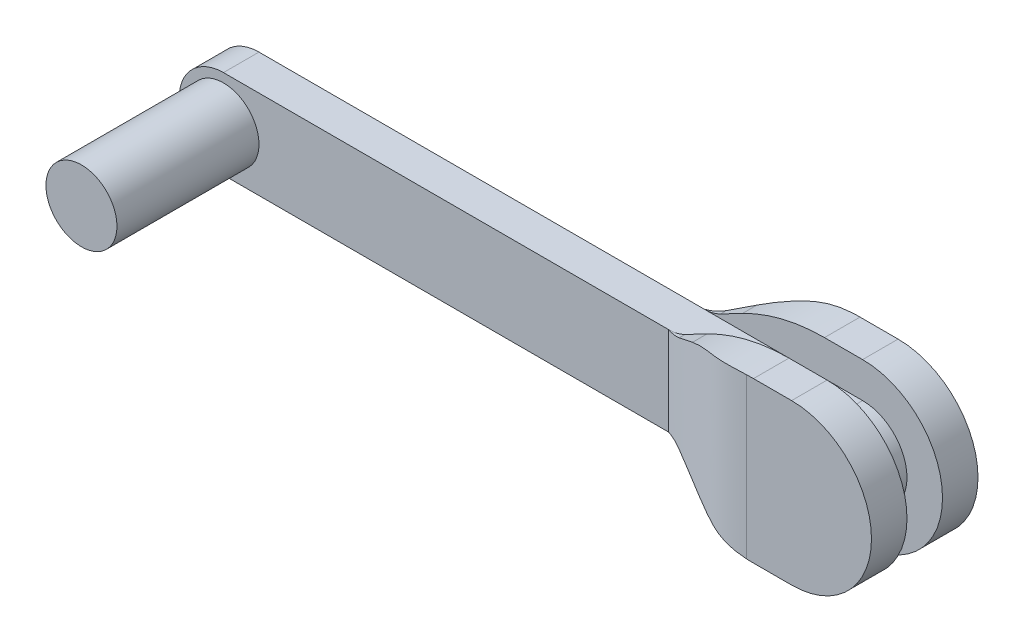
from build123d import *

# Parameters (mm, degrees)
BOSS_EXTRUDE1_DEPTH = 2
SKETCH2_R           = 2
BOSS_EXTRUDE2_DEPTH = 8
SKETCH5_R           = 2
CUT_EXTRUDE2_DEPTH  = 4
BOSS_EXTRUDE3_DEPTH = 2
CUT_EXTRUDE1_DEPTH  = 5.5


with BuildPart() as part:
    # Sketch1 → Boss-Extrude1 (new body)
    with BuildSketch(Plane.XY):
        with BuildLine():
            Line((0, -2.5), (34, -2.5))
            ThreePointArc((34, -2.5), (36.5, 0), (34, 2.5))
            Line((34, 2.5), (0, 2.5))
            ThreePointArc((0, 2.5), (-2.5, 0), (0, -2.5))
        make_face()
    extrude(amount=BOSS_EXTRUDE1_DEPTH)

    # Sketch2 → Boss-Extrude2 (add)
    with BuildSketch(Plane.XY.offset(2)):
        Circle(SKETCH2_R)
    extrude(amount=BOSS_EXTRUDE2_DEPTH)

    # Sketch5 → Cut-Extrude2 (cut, symmetric)
    with BuildSketch(Plane(origin=(0, 0, 0), x_dir=(-1, 0, 0), z_dir=(0, 0, -1))):
        with Locations(Location((-34, 0, 0), (0, 0, 180))):
            Circle(SKETCH5_R)
    extrude(amount=CUT_EXTRUDE2_DEPTH, both=True, mode=Mode.SUBTRACT)

    # Sketch3 → Boss-Extrude3 (add)
    with BuildSketch(Plane(origin=(0, 0, 0), x_dir=(-1, 0, 0), z_dir=(0, 0, -1))):
        with BuildLine():
            Line((-34, -4.5), (-31.853983948, -4.5))
            ThreePointArc((-31.853983948, -4.5), (-29.476132044, -4.213177664), (-27.234684348, -3.369164065))
            Line((-27.234684348, -3.369164065), (-26.000115193, -2.726167187))
            ThreePointArc((-26.000115193, -2.726167187), (-25.551825654, -2.557364467), (-25.076255273, -2.5))
            Line((-25.076255273, -2.5), (-25.076255273, 2.5))
            ThreePointArc((-25.076255273, 2.5), (-25.551825654, 2.557364467), (-26.000115193, 2.726167187))
            Line((-26.000115193, 2.726167187), (-27.234684348, 3.369164065))
            ThreePointArc((-27.234684348, 3.369164065), (-29.476132044, 4.213177664), (-31.853983948, 4.5))
            Line((-31.853983948, 4.5), (-34, 4.5))
            ThreePointArc((-34, 4.5), (-38.5, 0), (-34, -4.5))
        make_face()
    boss_extrude3 = extrude(amount=BOSS_EXTRUDE3_DEPTH)

    # Sketch4 → Cut-Extrude1 (cut, symmetric)
    with BuildSketch(Plane(origin=(0, 0, 0), x_dir=(1, 0, 0), z_dir=(0, 1, 0))):
        with BuildLine():
            Line((31.853983948, 2), (31.853983948, 3.174344261))
            Line((31.853983948, 3.174344261), (24.383890118, 3.174344261))
            Line((24.383890118, 3.174344261), (25.076255273, 0))
            add(Edge.make_bspline(
                [(31.853983948, 2), (29.962456018, 2.02071595), (29.16990367, 1.605069608), (25.966821868, 0.283607958), (25.076255273, 0)],
                knots=[0, 0, 0, 0, 0.608348739, 1, 1, 1, 1], degree=3))
        make_face()
    cut_extrude1 = extrude(amount=CUT_EXTRUDE1_DEPTH, both=True, mode=Mode.SUBTRACT)

    # Mirror1: Boss-Extrude3, Cut-Extrude1 across plane
    add(boss_extrude3.mirror(Plane.XY.offset(1)))
    add(cut_extrude1.mirror(Plane.XY.offset(1)), mode=Mode.SUBTRACT)


solid = part.part
